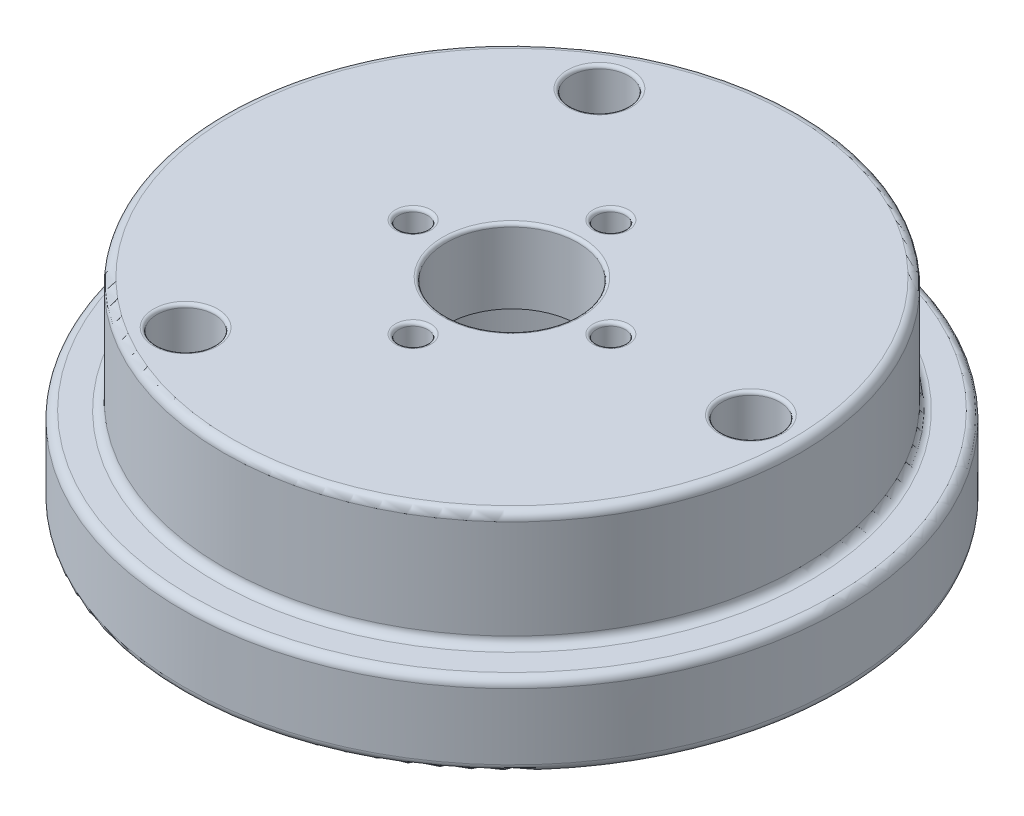
from build123d import *

# Parameters (mm, degrees)
SKETCH2_R          = 1.75
SKETCH2_R_2        = 4
SKETCH2_R_3        = 0.875
CUT_EXTRUDE1_DEPTH = 31.724582991
SKETCH2_3_R        = 10
SKETCH2_3_R_2      = 0.875
SKETCH2_3_R_3      = 4
CUT_EXTRUDE2_DEPTH = 7.5
FILLET1_R          = 0.5
FILLET2_R          = 0.2
FILLET3_R          = 0.1


with BuildPart() as part:
    # Sketch1 → Revolve1 (revolve)
    with BuildSketch(Plane.XY):
        Polygon((0, 0), (-20, 0), (-20, 5), (-17.5, 5), (-17.5, 12), (0, 12), align=None)
    revolve(axis=Axis((0, 0, 0), (0, 1, 0)))

    # Sketch2 → Cut-Extrude1 (cut, through all)
    with BuildSketch(Plane.XZ):
        with Locations((14.5, 0)):
            Circle(SKETCH2_R)
        with Locations((-7.25, -12.557368355)):
            Circle(SKETCH2_R)
        with Locations((-7.25, 12.557368355)):
            Circle(SKETCH2_R)
        Circle(SKETCH2_R_2)
        with Locations((6, 0)):
            Circle(SKETCH2_R_3)
        with Locations((0, -6)):
            Circle(SKETCH2_R_3)
        with Locations((-6, 0)):
            Circle(SKETCH2_R_3)
        with Locations((0, 6)):
            Circle(SKETCH2_R_3)
    extrude(amount=-CUT_EXTRUDE1_DEPTH, mode=Mode.SUBTRACT)

    # Sketch2<3> → Cut-Extrude2 (cut)
    with BuildSketch(Plane.XZ):
        Circle(SKETCH2_3_R)
        with Locations((-6, 0)):
            Circle(SKETCH2_3_R_2, mode=Mode.SUBTRACT)
        with Locations((0, -6)):
            Circle(SKETCH2_3_R_2, mode=Mode.SUBTRACT)
        Circle(SKETCH2_3_R_3, mode=Mode.SUBTRACT)
        with Locations((6, 0)):
            Circle(SKETCH2_3_R_2, mode=Mode.SUBTRACT)
        with Locations((0, 6)):
            Circle(SKETCH2_3_R_2, mode=Mode.SUBTRACT)
    extrude(amount=-CUT_EXTRUDE2_DEPTH, mode=Mode.SUBTRACT)

    # Fillet1
    fillet1_edges = [part.edges().sort_by_distance(p)[0] for p in [
        (20, 0, 0),
        (20, 5, 0),
        (17.5, 5, 0),
        (17.5, 12, 0),
    ]]
    fillet(fillet1_edges, radius=FILLET1_R)

    # Fillet2
    fillet2_edges = [part.edges().sort_by_distance(p)[0] for p in [
        (-4, 12, 0),
        (12.75, 12, 0),
        (-9, 12, 12.557368355),
        (-6.875, 12, 0),
        (-0.875, 12, -6),
        (5.125, 12, 0),
        (-0.875, 12, 6),
        (-9, 12, -12.557368355),
    ]]
    fillet(fillet2_edges, radius=FILLET2_R)

    # Fillet3
    fillet3_edges = [part.edges().sort_by_distance(p)[0] for p in [
        (-9, 0, -12.557368355),
        (12.75, 0, 0),
        (-9, 0, 12.557368355),
        (-10, 0, 0),
    ]]
    fillet(fillet3_edges, radius=FILLET3_R)


solid = part.part
